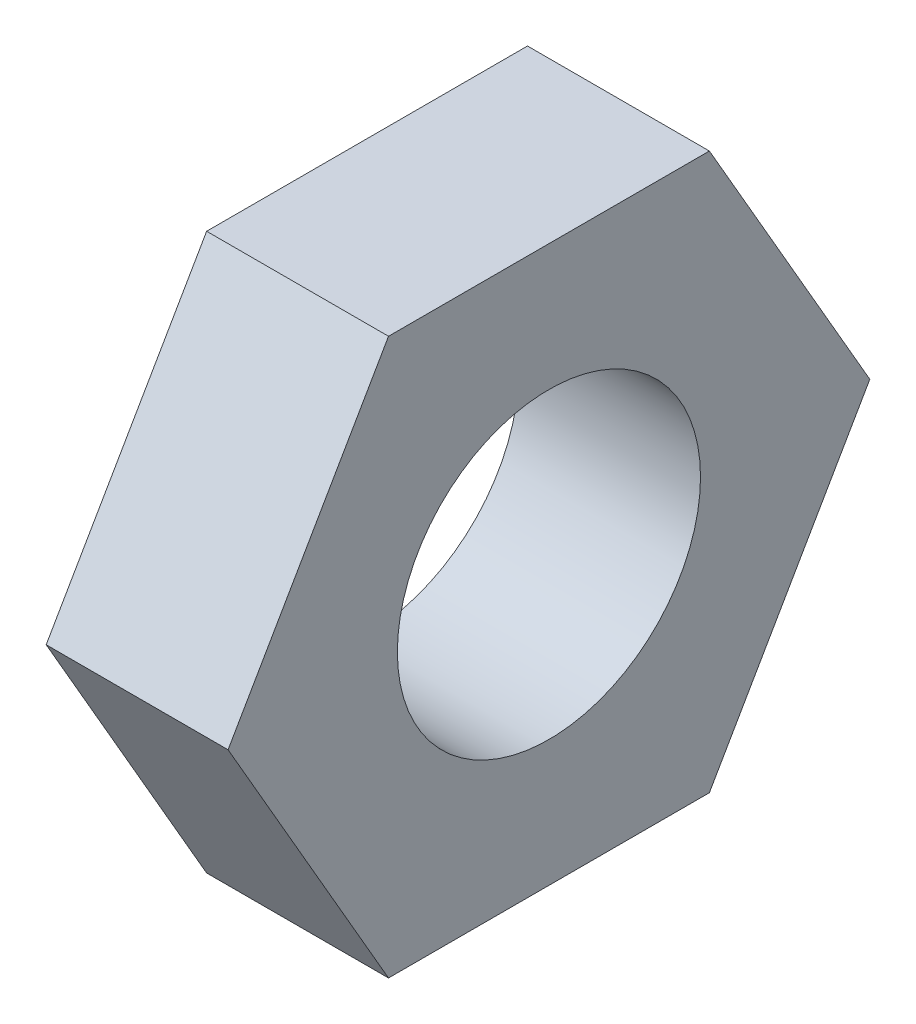
from build123d import *

# Parameters (mm, degrees)
NUT_DEPTH       = 1.8
THREAD_SKETCH_W = 3.8
THREAD_SKETCH_H = 1.5


with BuildPart() as part:
    # Nut Sketch → Nut (new body)
    with BuildSketch(Plane(origin=(0, 0, 0), x_dir=(0, 0, -1), z_dir=(1, 0, 0))):
        Polygon((3.175426481, 0), (1.58771324, 2.75), (-1.58771324, 2.75), (-3.175426481, 0), (-1.58771324, -2.75), (1.58771324, -2.75), align=None)
    extrude(amount=NUT_DEPTH)

    # Thread Sketch → Thread (revolve, cut)
    with BuildSketch(Plane.XY):
        with Locations((0.9, 0.75)):
            Rectangle(THREAD_SKETCH_W, THREAD_SKETCH_H)
    revolve(axis=Axis((-1000, 0, 0), (1, 0, 0)), mode=Mode.SUBTRACT)


solid = part.part
